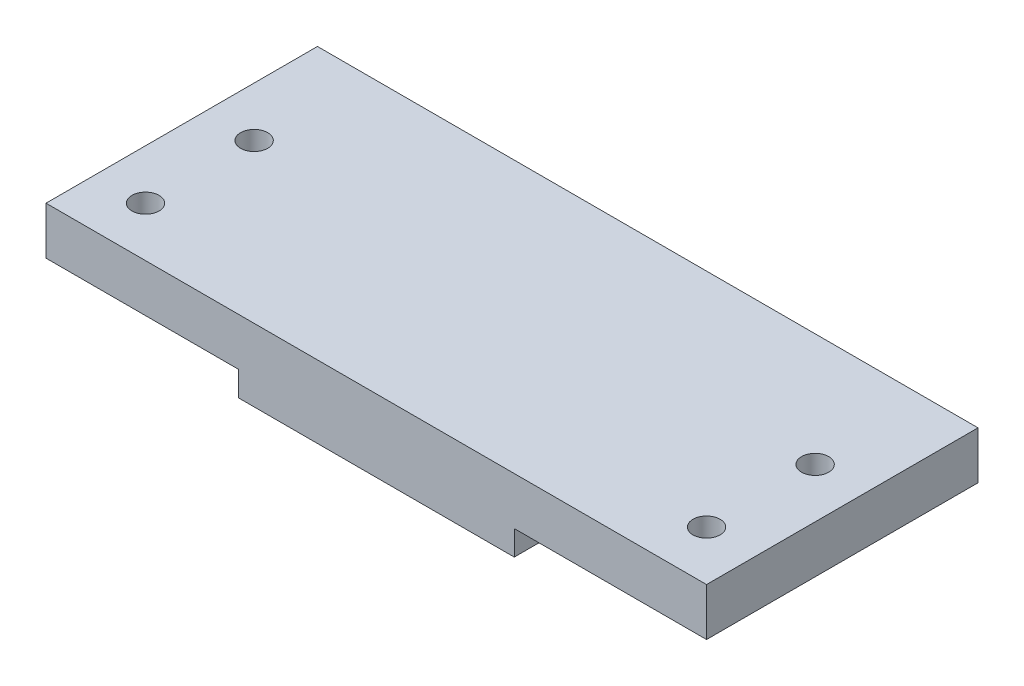
from build123d import *

# Parameters (mm, degrees)
SKETCH_1_W          = 73
SKETCH_1_H          = 30
EXTRUDE_1_DEPTH     = 8
SKETCH_2_W          = 21.25
SKETCH_2_H          = 2.735303139
CUT_EXTRUDE_1_DEPTH = 48.919202831
SKETCH_3_R          = 1.5
CUT_EXTRUDE_2_DEPTH = 45


with BuildPart() as part:
    # 草图1 → 凸台-拉伸1 (new body)
    with BuildSketch(Plane(origin=(0, 0, 0), x_dir=(1, 0, 0), z_dir=(0, 1, 0))):
        Rectangle(SKETCH_1_W, SKETCH_1_H)
    extrude(amount=EXTRUDE_1_DEPTH)

    # 草图2 → 切除-拉伸1 (cut, through all)
    with BuildSketch(Plane(origin=(0, 0, -15), x_dir=(-1, 0, 0), z_dir=(0, 0, -1))):
        with Locations((-25.875, 1.367651569)):
            Rectangle(SKETCH_2_W, SKETCH_2_H)
        with Locations((25.875, 1.367651569)):
            Rectangle(SKETCH_2_W, SKETCH_2_H)
    extrude(amount=-CUT_EXTRUDE_1_DEPTH, mode=Mode.SUBTRACT)

    # 草图3 → 切除-拉伸2 (cut, symmetric)
    with BuildSketch(Plane(origin=(59.282070169, -20, -16.5), x_dir=(1, 0, 0), z_dir=(0, -1, 0))):
        with Locations((-28.282070169, 14)):
            Circle(SKETCH_3_R)
        with Locations((-90.282070169, 14)):
            Circle(SKETCH_3_R)
        with Locations((-90.282070169, 26)):
            Circle(SKETCH_3_R)
        with Locations((-28.282070169, 26)):
            Circle(SKETCH_3_R)
    extrude(amount=CUT_EXTRUDE_2_DEPTH, both=True, mode=Mode.SUBTRACT)


solid = part.part
